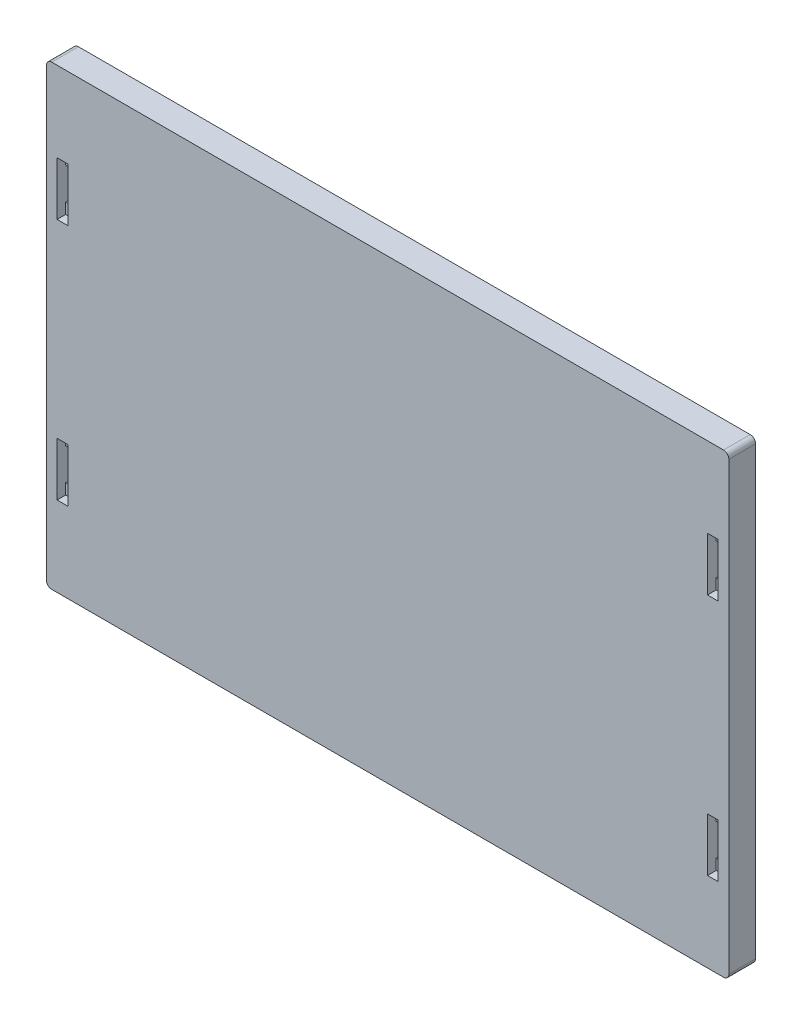
from build123d import *

# Parameters (mm, degrees)
SKETCH1_W               = 127.76
SKETCH1_H               = 85.48
BOSS_EXTRUDE1_DEPTH     = 5
SKETCH3_W               = 2
SKETCH3_H               = 10
CUT_EXTRUDE2_DEPTH      = 1.6
SKETCH4_W               = 2
SKETCH4_H               = 6
CUT_EXTRUDE3_DEPTH      = 95.754317257
MIRROR2_COPY_1_SKETCH_W = 2
MIRROR2_COPY_1_SKETCH_H = 10
MIRROR2_COPY_1_DEPTH    = 1.6
MIRROR2_COPY_2_SKETCH_W = 2
MIRROR2_COPY_2_SKETCH_H = 6
MIRROR2_COPY_2_DEPTH    = 95.754317257
SKETCH6_R               = 12.75
CUT_EXTRUDE4_DEPTH      = 4.4
FILLET1_R               = 1


with BuildPart() as part:
    # Sketch1 → Boss-Extrude1 (new body)
    with BuildSketch(Plane.XY):
        with Locations((9.206235294, -17.469823529)):
            Rectangle(SKETCH1_W, SKETCH1_H)
    extrude(amount=BOSS_EXTRUDE1_DEPTH)

    # Sketch3 → Cut-Extrude2 (cut)
    with BuildSketch(Plane.XY.offset(5)):
        with Locations((-51.673764706, 5.270176471)):
            Rectangle(SKETCH3_W, SKETCH3_H)
    cut_extrude2 = extrude(amount=-CUT_EXTRUDE2_DEPTH, mode=Mode.SUBTRACT)

    # Sketch4 → Cut-Extrude3 (cut, through all)
    with BuildSketch(Plane.XY.offset(3.4)):
        with Locations((-51.673764706, 5.270176471)):
            Rectangle(SKETCH4_W, SKETCH4_H)
    cut_extrude3 = extrude(amount=-CUT_EXTRUDE3_DEPTH, mode=Mode.SUBTRACT)

    # Mirror1: Cut-Extrude2, Cut-Extrude3 across plane
    add(cut_extrude2.mirror(Plane.ZY.offset(-9.206235294)), mode=Mode.SUBTRACT)
    add(cut_extrude3.mirror(Plane.ZY.offset(-9.206235294)), mode=Mode.SUBTRACT)

    # Mirror2: Cut-Extrude2, Cut-Extrude3 across plane
    add(cut_extrude2.mirror(Plane.ZX.offset(-17.469823529)), mode=Mode.SUBTRACT)
    add(cut_extrude3.mirror(Plane.ZX.offset(-17.469823529)), mode=Mode.SUBTRACT)

    # Mirror2 copy 1 sketch → Mirror2 copy 1 (cut)
    with BuildSketch(Plane(origin=(18.412470588, -34.939647059, 5), x_dir=(-1, 0, 0), z_dir=(0, 0, 1))):
        with Locations((-51.673764706, 5.270176471)):
            Rectangle(MIRROR2_COPY_1_SKETCH_W, MIRROR2_COPY_1_SKETCH_H)
    extrude(amount=-MIRROR2_COPY_1_DEPTH, mode=Mode.SUBTRACT)

    # Mirror2 copy 2 sketch → Mirror2 copy 2 (cut, through all)
    with BuildSketch(Plane(origin=(18.412470588, -34.939647059, 3.4), x_dir=(-1, 0, 0), z_dir=(0, 0, 1))):
        with Locations((-51.673764706, 5.270176471)):
            Rectangle(MIRROR2_COPY_2_SKETCH_W, MIRROR2_COPY_2_SKETCH_H)
    extrude(amount=-MIRROR2_COPY_2_DEPTH, mode=Mode.SUBTRACT)

    # Sketch6 → Cut-Extrude4 (cut)
    with BuildSketch(Plane(origin=(0, 0, 0), x_dir=(-1, 0, 0), z_dir=(0, 0, -1))):
        with Locations((-9.206235294, -17.469823529)):
            Circle(SKETCH6_R)
    extrude(amount=-CUT_EXTRUDE4_DEPTH, mode=Mode.SUBTRACT)

    # Fillet1
    fillet1_edges = [part.edges().sort_by_distance(p)[0] for p in [
        (-54.673764706, 25.270176471, 2.5),
        (73.086235294, 25.270176471, 2.5),
        (73.086235294, -60.209823529, 2.5),
        (-54.673764706, -60.209823529, 2.5),
    ]]
    fillet(fillet1_edges, radius=FILLET1_R)


solid = part.part
